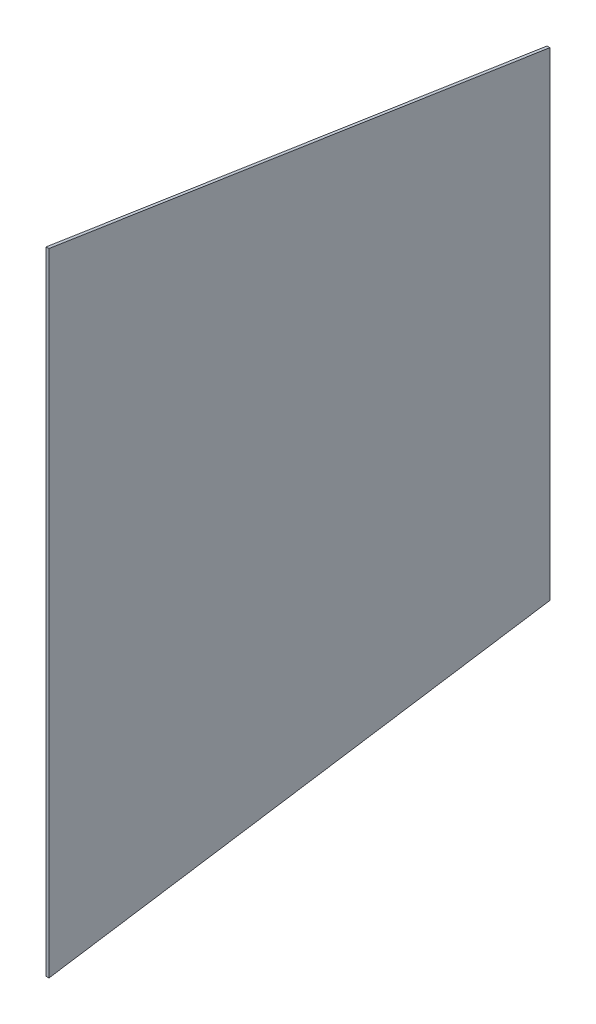
from build123d import *

# Parameters (mm, degrees)
BOSS_EXTRUDE1_DEPTH = 1.5875


with BuildPart() as part:
    # Sketch2 → Boss-Extrude1 (new body)
    with BuildSketch(Plane(origin=(14.2875, 0, 0), x_dir=(0, 0, -1), z_dir=(1, 0, 0))):
        Polygon((166.6875, 174.17423447), (166.6875, -174.17423447), (442.9125, -131.986549459), (442.9125, 131.986549459), align=None)
    extrude(amount=BOSS_EXTRUDE1_DEPTH)


solid = part.part
